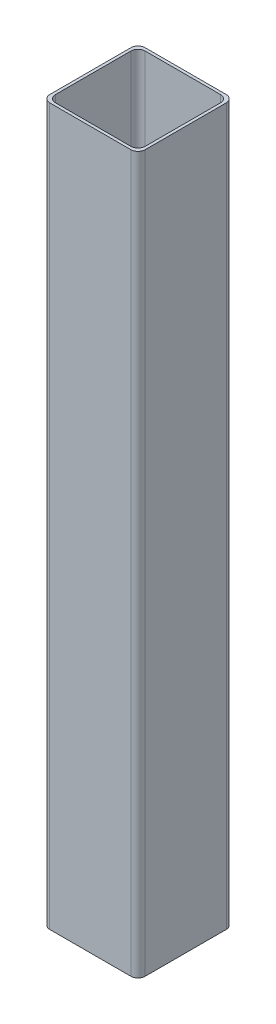
from build123d import *

# Parameters (mm, degrees)
ESBO_O1_W                = 40
ESBO_O1_H                = 40
ESBO_O1_W_2              = 37.6
ESBO_O1_H_2              = 37.6
RESSALTO_EXTRUS_O1_DEPTH = 150
FILETE1_R                = 3


with BuildPart() as part:
    # Esboço1 → Ressalto-extrusão1 (new, symmetric)
    with BuildSketch(Plane(origin=(0, 0, 0), x_dir=(1, 0, 0), z_dir=(0, 1, 0))):
        Rectangle(ESBO_O1_W, ESBO_O1_H)
        Rectangle(ESBO_O1_W_2, ESBO_O1_H_2, mode=Mode.SUBTRACT)
    extrude(amount=RESSALTO_EXTRUS_O1_DEPTH, both=True)

    # Filete1
    filete1_edges = [part.edges().sort_by_distance(p)[0] for p in [
        (-18.8, 0, 18.8),
        (18.8, 0, 18.8),
        (18.8, 0, -18.8),
        (-18.8, 0, -18.8),
        (-20, 0, -20),
        (20, 0, -20),
        (20, 0, 20),
        (-20, 0, 20),
    ]]
    fillet(filete1_edges, radius=FILETE1_R)


solid = part.part
